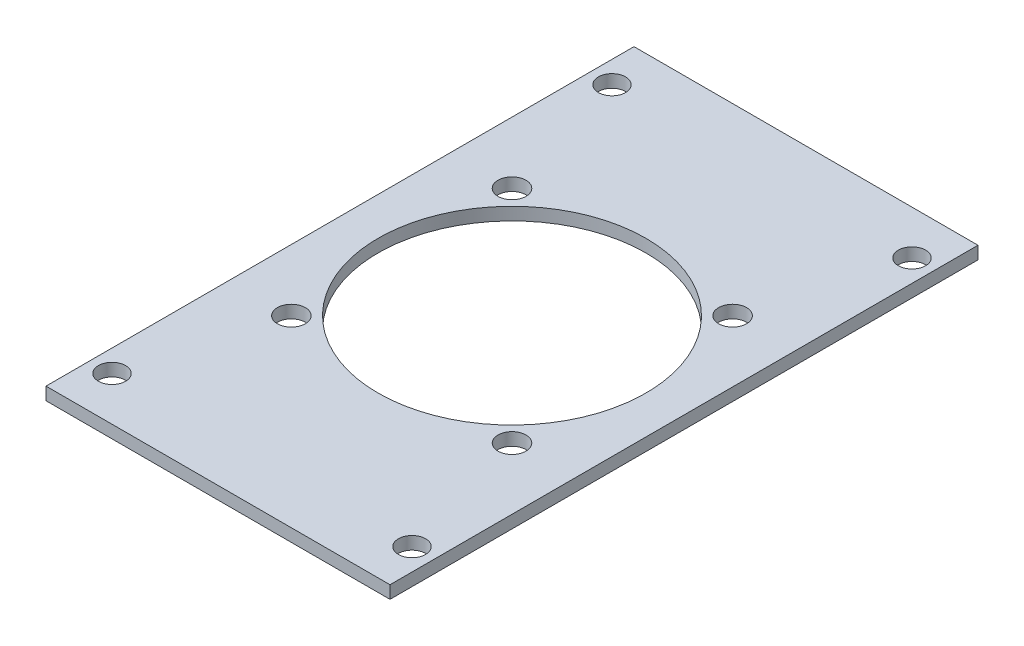
from build123d import *

# Parameters (mm, degrees)
SKETCH1_W           = 86
SKETCH1_H           = 147
SKETCH1_R           = 33.5
SKETCH1_R_2         = 3.4
BOSS_EXTRUDE1_DEPTH = 3.175
SKETCH2_R           = 3.5
CUT_EXTRUDE1_DEPTH  = 10


with BuildPart() as part:
    # Sketch1 → Boss-Extrude1 (new body)
    with BuildSketch(Plane(origin=(0, 0, 0), x_dir=(1, 0, 0), z_dir=(0, 1, 0))):
        Rectangle(SKETCH1_W, SKETCH1_H)
        with Locations(Location((0, 0, 0), (0, 0, 270))):
            Circle(SKETCH1_R, mode=Mode.SUBTRACT)
        with Locations(Location((-37.5, -62.5, 0), (0, 0, 270))):
            Circle(SKETCH1_R_2, mode=Mode.SUBTRACT)
        with Locations(Location((37.5, -62.5, 0), (0, 0, 270))):
            Circle(SKETCH1_R_2, mode=Mode.SUBTRACT)
        with Locations(Location((-37.5, 62.5, 0), (0, 0, 270))):
            Circle(SKETCH1_R_2, mode=Mode.SUBTRACT)
        with Locations(Location((37.5, 62.5, 0), (0, 0, 270))):
            Circle(SKETCH1_R_2, mode=Mode.SUBTRACT)
    extrude(amount=BOSS_EXTRUDE1_DEPTH)

    # Sketch2 → Cut-Extrude1 (cut)
    with BuildSketch(Plane(origin=(0, 3.175, 0), x_dir=(1, 0, 0), z_dir=(0, 1, 0))):
        with Locations(Location((-27.577164466, 27.577164466, 0), (0, 0, 270))):
            Circle(SKETCH2_R)
        with Locations(Location((27.577164466, 27.577164466, 0), (0, 0, 270))):
            Circle(SKETCH2_R)
        with Locations(Location((27.577164466, -27.577164466, 0), (0, 0, 270))):
            Circle(SKETCH2_R)
        with Locations(Location((-27.577164466, -27.577164466, 0), (0, 0, 270))):
            Circle(SKETCH2_R)
    extrude(amount=-CUT_EXTRUDE1_DEPTH, mode=Mode.SUBTRACT)


solid = part.part
